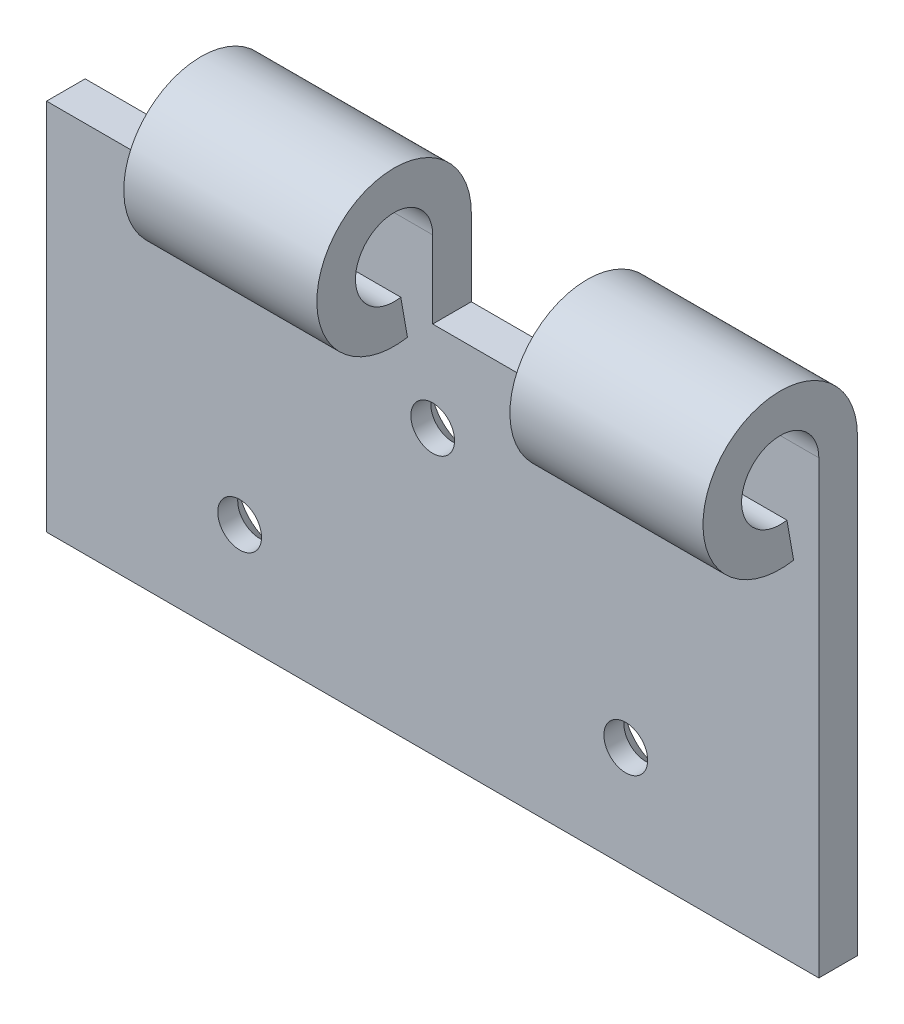
from build123d import *

# Parameters (mm, degrees)
SKETCH1_W                                           = 60
SKETCH1_H                                           = 35
BOSS_EXTRUDE1_DEPTH                                 = 3
BOSS_EXTRUDE2_DEPTH                                 = 60
CUT_EXTRUDE4_DEPTH                                  = 49.961719741
CUT_EXTRUDE4_DEPTH_BACK                             = 49.961719741
SKETCH9_W                                           = 15
SKETCH9_H                                           = 12
CSK_FOR_M3_COUNTERSUNK_FLAT_HEAD_SCREW1_D           = 3.4
CSK_FOR_M3_COUNTERSUNK_FLAT_HEAD_SCREW1_DEPTH       = 3
CSK_FOR_M3_COUNTERSUNK_FLAT_HEAD_SCREW1_CSINK_D     = 6.3
CSK_FOR_M3_COUNTERSUNK_FLAT_HEAD_SCREW1_CSINK_ANGLE = 90
CSK_FOR_M3_COUNTERSUNK_FLAT_HEAD_SCREW1_TIP         = 1.021463052


with BuildPart() as part:
    # Sketch1 → Boss-Extrude1 (new body)
    with BuildSketch(Plane.XY):
        Rectangle(SKETCH1_W, SKETCH1_H)
    extrude(amount=BOSS_EXTRUDE1_DEPTH)

    # Sketch5 → Boss-Extrude2 (add)
    with BuildSketch(Plane(origin=(30, 0, 0), x_dir=(0, 0, -1), z_dir=(1, 0, 0))):
        with BuildLine():
            Line((-5.479055467, 14.545576741), (-4.958110934, 11.591153482))
            ThreePointArc((-4.958110934, 11.591153482), (-8.05212086, 23.138155725), (-3, 12.303847577))
            Line((-3, 12.303847577), (-3, 17.5))
            ThreePointArc((-3, 17.5), (-8.298133329, 19.428362829), (-5.479055467, 14.545576741))
        make_face()
    extrude(amount=-BOSS_EXTRUDE2_DEPTH)

    # Sketch9 → Cut-Extrude4 (cut, two sides: drawn at the far end of the back side and taken through both)
    with BuildSketch(Plane(origin=(-12, 0, 3), x_dir=(-1, 0, 0), z_dir=(0, 0, -1)).offset(-CUT_EXTRUDE4_DEPTH_BACK)):
        with Locations((-19.5, 17.5)):
            Rectangle(SKETCH9_W, SKETCH9_H)
        with Locations((10.5, 17.5)):
            Rectangle(SKETCH9_W, SKETCH9_H)
    extrude(amount=CUT_EXTRUDE4_DEPTH + CUT_EXTRUDE4_DEPTH_BACK, mode=Mode.SUBTRACT)

    # CSK for M3 Countersunk Flat Head Screw1
    with Locations(Plane(origin=(0, 0, 0), x_dir=(1, 0, 0), z_dir=(0, 0, -1))):
        with Locations((0, -4.5), (-15, 9.5), (15, 9.5)):
            CounterSinkHole(CSK_FOR_M3_COUNTERSUNK_FLAT_HEAD_SCREW1_D / 2, CSK_FOR_M3_COUNTERSUNK_FLAT_HEAD_SCREW1_CSINK_D / 2, depth=CSK_FOR_M3_COUNTERSUNK_FLAT_HEAD_SCREW1_DEPTH, counter_sink_angle=CSK_FOR_M3_COUNTERSUNK_FLAT_HEAD_SCREW1_CSINK_ANGLE)
            with Locations((0, 0, -(CSK_FOR_M3_COUNTERSUNK_FLAT_HEAD_SCREW1_DEPTH + CSK_FOR_M3_COUNTERSUNK_FLAT_HEAD_SCREW1_TIP / 2))):  # 118° drill point
                Cone(0, CSK_FOR_M3_COUNTERSUNK_FLAT_HEAD_SCREW1_D / 2, CSK_FOR_M3_COUNTERSUNK_FLAT_HEAD_SCREW1_TIP, mode=Mode.SUBTRACT)


solid = part.part
